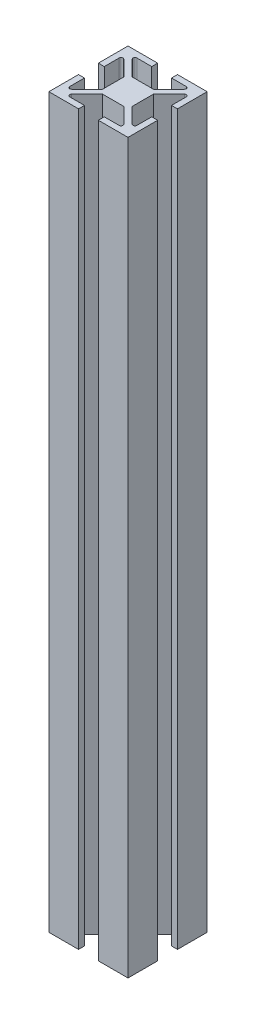
from build123d import *

# Parameters (mm, degrees)
BOSS_EXTRU_1_DEPTH = 184


with BuildPart() as part:
    # Esquisse1 → Boss.-Extru.1 (new body)
    with BuildSketch(Plane(origin=(0, 0, 0), x_dir=(1, 0, 0), z_dir=(0, 1, 0))):
        with BuildLine():
            Line((-10, -2.5), (-10, -10))
            Line((-10, -10), (-2.5, -10))
            Line((-2.5, -10), (-2.5, -8.5))
            Line((-2.5, -8.5), (-6.232233047, -8.5))
            ThreePointArc((-6.232233047, -8.5), (-6.694172813, -8.191341716), (-6.585786438, -7.646446609))
            Line((-6.585786438, -7.646446609), (-2.689339828, -3.75))
            Line((-2.689339828, -3.75), (2.689339828, -3.75))
            Line((2.689339828, -3.75), (6.585786438, -7.646446609))
            ThreePointArc((6.585786438, -7.646446609), (6.694172813, -8.191341716), (6.232233047, -8.5))
            Line((6.232233047, -8.5), (2.5, -8.5))
            Line((2.5, -8.5), (2.5, -10))
            Line((2.5, -10), (10, -10))
            Line((10, -10), (10, -2.5))
            Line((10, -2.5), (8.5, -2.5))
            Line((8.5, -2.5), (8.5, -6.232233047))
            ThreePointArc((8.5, -6.232233047), (8.191341716, -6.694172813), (7.646446609, -6.585786438))
            Line((7.646446609, -6.585786438), (3.75, -2.689339828))
            Line((3.75, -2.689339828), (3.75, 2.689339828))
            Line((3.75, 2.689339828), (7.646446609, 6.585786438))
            ThreePointArc((7.646446609, 6.585786438), (8.191341716, 6.694172813), (8.5, 6.232233047))
            Line((8.5, 6.232233047), (8.5, 2.5))
            Line((8.5, 2.5), (10, 2.5))
            Line((10, 2.5), (10, 10))
            Line((10, 10), (2.5, 10))
            Line((2.5, 10), (2.5, 8.5))
            Line((2.5, 8.5), (6.232233047, 8.5))
            ThreePointArc((6.232233047, 8.5), (6.694172813, 8.191341716), (6.585786438, 7.646446609))
            Line((6.585786438, 7.646446609), (2.689339828, 3.75))
            Line((2.689339828, 3.75), (-2.689339828, 3.75))
            Line((-2.689339828, 3.75), (-6.585786438, 7.646446609))
            ThreePointArc((-6.585786438, 7.646446609), (-6.694172813, 8.191341716), (-6.232233047, 8.5))
            Line((-6.232233047, 8.5), (-2.5, 8.5))
            Line((-2.5, 8.5), (-2.5, 10))
            Line((-2.5, 10), (-10, 10))
            Line((-10, 10), (-10, 2.5))
            Line((-10, 2.5), (-8.5, 2.5))
            Line((-8.5, 2.5), (-8.5, 6.232233047))
            ThreePointArc((-8.5, 6.232233047), (-8.191341716, 6.694172813), (-7.646446609, 6.585786438))
            Line((-7.646446609, 6.585786438), (-3.75, 2.689339828))
            Line((-3.75, 2.689339828), (-3.75, -2.689339828))
            Line((-3.75, -2.689339828), (-7.646446609, -6.585786438))
            ThreePointArc((-7.646446609, -6.585786438), (-8.191341716, -6.694172813), (-8.5, -6.232233047))
            Line((-8.5, -6.232233047), (-8.5, -2.5))
            Line((-8.5, -2.5), (-10, -2.5))
        make_face()
    extrude(amount=BOSS_EXTRU_1_DEPTH)


solid = part.part
